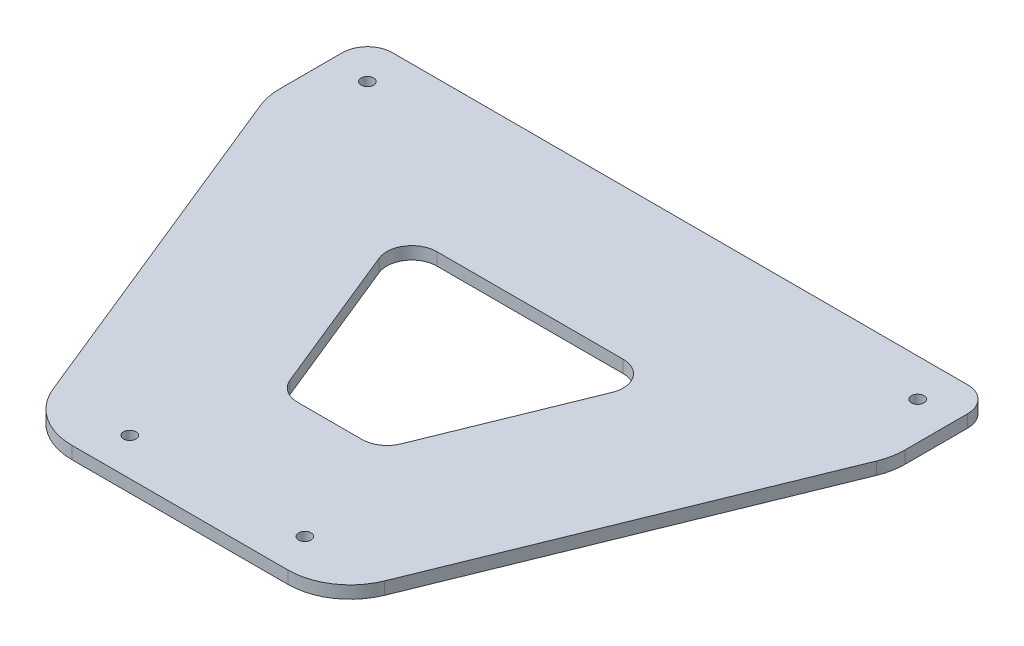
from build123d import *

# Parameters (mm, degrees)
RESSALTO_EXTRUS_O1_DEPTH = 5
ESBO_O2_R                = 2.5
CORTE_EXTRUS_O1_DEPTH    = 5
CORTE_EXTRUS_O2_DEPTH    = 10


with BuildPart() as part:
    # Esboço1 → Ressalto-extrusão1 (new body)
    with BuildSketch(Plane(origin=(0, 0, 0), x_dir=(1, 0, 0), z_dir=(0, 1, 0))):
        with BuildLine():
            Line((68.172006189, -100), (-18.172006189, -100))
            ThreePointArc((-18.172006189, -100), (-32.132026705, -95.739282224), (-41.333670617, -84.409426174))
            Line((-41.333670617, -84.409426174), (-98.161664428, 55.474866284))
            ThreePointArc((-98.161664428, 55.474866284), (-99.536112271, 60.090630534), (-100, 64.884292458))
            Line((-100, 64.884292458), (-100, 90))
            ThreePointArc((-100, 90), (-97.071067812, 97.071067812), (-90, 100))
            Line((-90, 100), (140, 100))
            ThreePointArc((140, 100), (147.071067812, 97.071067812), (150, 90))
            Line((150, 90), (150, 64.884292458))
            ThreePointArc((150, 64.884292458), (149.536112271, 60.090630534), (148.161664428, 55.474866284))
            Line((148.161664428, 55.474866284), (91.333670617, -84.409426174))
            ThreePointArc((91.333670617, -84.409426174), (82.132026705, -95.739282224), (68.172006189, -100))
        make_face()
    extrude(amount=RESSALTO_EXTRUS_O1_DEPTH)

    # Esboço2 → Corte-extrusão1 (cut)
    with BuildSketch(Plane(origin=(0, 5, 0), x_dir=(1, 0, 0), z_dir=(0, 1, 0))):
        with Locations(Location((-85, 85, 0), (0, 0, 270))):
            Circle(ESBO_O2_R)
        with Locations(Location((-10, -85, 0), (0, 0, 270))):
            Circle(ESBO_O2_R)
        with Locations(Location((60, -85, 0), (0, 0, 270))):
            Circle(ESBO_O2_R)
        with Locations(Location((135, 85, 0), (0, 0, 270))):
            Circle(ESBO_O2_R)
    extrude(amount=-CORTE_EXTRUS_O1_DEPTH, mode=Mode.SUBTRACT)

    # Esboço3 → Corte-extrusão2 (cut)
    with BuildSketch(Plane(origin=(0, 5, 0), x_dir=(1, 0, 0), z_dir=(0, 1, 0))):
        with BuildLine():
            Line((-21.5212831, 26.23622953), (2.8537169, -33.76377047))
            ThreePointArc((2.8537169, -33.76377047), (6.534374465, -38.29571289), (12.118382671, -40))
            Line((12.118382671, -40), (37.881617329, -40))
            ThreePointArc((37.881617329, -40), (43.465625535, -38.29571289), (47.1462831, -33.76377047))
            Line((47.1462831, -33.76377047), (71.5212831, 26.23622953))
            ThreePointArc((71.5212831, 26.23622953), (70.552330218, 35.584008207), (62.256617329, 40))
            Line((62.256617329, 40), (-12.256617329, 40))
            ThreePointArc((-12.256617329, 40), (-20.552330218, 35.584008207), (-21.5212831, 26.23622953))
        make_face()
    extrude(amount=-CORTE_EXTRUS_O2_DEPTH, mode=Mode.SUBTRACT)


solid = part.part
